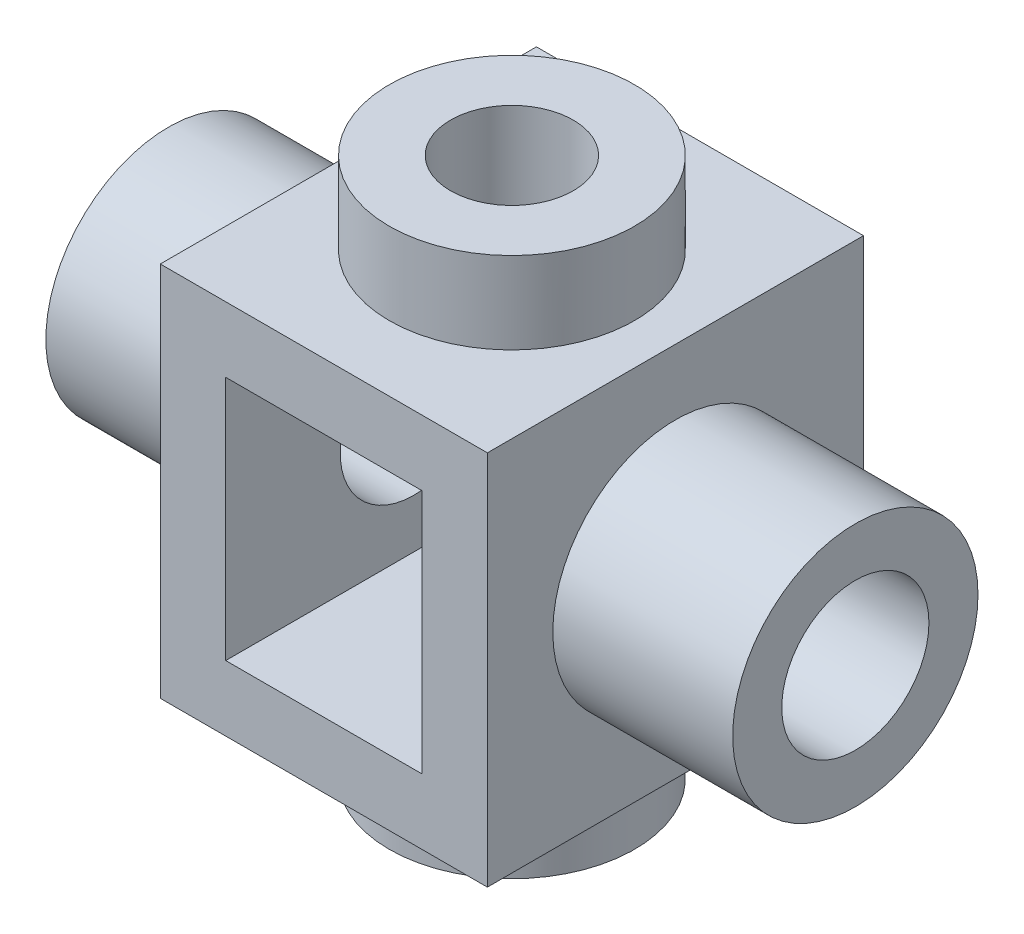
from build123d import *

# Parameters (mm, degrees)
SKETCH1_W                = 40
SKETCH1_H                = 46
BOSS_EXTRUDE1_DEPTH      = 46
BOSS_EXTRUDE2_DEPTH      = 10
BOSS_EXTRUDE2_DEPTH_BACK = 56
SKETCH2_R                = 15
SKETCH2_R_2              = 7.5
BOSS_EXTRUDE3_DEPTH      = 22
BOSS_EXTRUDE3_DEPTH_BACK = 62
SKETCH3_R                = 15
SKETCH3_R_2              = 9
SKETCH4_R                = 9
CUT_EXTRUDE1_DEPTH       = 130
SKETCH5_R                = 7.5
CUT_EXTRUDE2_DEPTH       = 130
SKETCH6_W                = 24
SKETCH6_H                = 30
CUT_EXTRUDE3_DEPTH       = 130


with BuildPart() as part:
    # Sketch1 → Boss-Extrude1 (new body)
    with BuildSketch(Plane.XY):
        with Locations((20, 23)):
            Rectangle(SKETCH1_W, SKETCH1_H)
    extrude(amount=BOSS_EXTRUDE1_DEPTH)

    # Sketch2 → Boss-Extrude2 (add, two sides: drawn at the far end of the back side and taken through both)
    with BuildSketch(Plane(origin=(0, 46, 0), x_dir=(1, 0, 0), z_dir=(0, 1, 0)).offset(-BOSS_EXTRUDE2_DEPTH_BACK)):
        with Locations(Location((20, -23, 0), (0, 0, 270))):
            Circle(SKETCH2_R)
        with Locations(Location((20, -23, 0), (0, 0, 270))):
            Circle(SKETCH2_R_2, mode=Mode.SUBTRACT)
    extrude(amount=BOSS_EXTRUDE2_DEPTH + BOSS_EXTRUDE2_DEPTH_BACK)

    # Sketch3 → Boss-Extrude3 (add, two sides: drawn at the far end of the back side and taken through both)
    with BuildSketch(Plane(origin=(40, 0, 0), x_dir=(0, 0, -1), z_dir=(1, 0, 0)).offset(-BOSS_EXTRUDE3_DEPTH_BACK)):
        with Locations((-23, 23)):
            Circle(SKETCH3_R)
        with Locations((-23, 23)):
            Circle(SKETCH3_R_2, mode=Mode.SUBTRACT)
    extrude(amount=BOSS_EXTRUDE3_DEPTH + BOSS_EXTRUDE3_DEPTH_BACK)

    # Sketch4 → Cut-Extrude1 (cut)
    with BuildSketch(Plane(origin=(40, 0, 0), x_dir=(0, 0, -1), z_dir=(1, 0, 0))):
        with Locations((-23, 23)):
            Circle(SKETCH4_R)
    extrude(amount=-CUT_EXTRUDE1_DEPTH, mode=Mode.SUBTRACT)

    # Sketch5 → Cut-Extrude2 (cut)
    with BuildSketch(Plane(origin=(0, 46, 0), x_dir=(1, 0, 0), z_dir=(0, 1, 0))):
        with Locations(Location((20, -23, 0), (0, 0, 270))):
            Circle(SKETCH5_R)
    extrude(amount=-CUT_EXTRUDE2_DEPTH, mode=Mode.SUBTRACT)

    # Sketch6 → Cut-Extrude3 (cut)
    with BuildSketch(Plane.XY.offset(46)):
        with Locations((20, 23)):
            Rectangle(SKETCH6_W, SKETCH6_H)
    extrude(amount=-CUT_EXTRUDE3_DEPTH, mode=Mode.SUBTRACT)


solid = part.part
